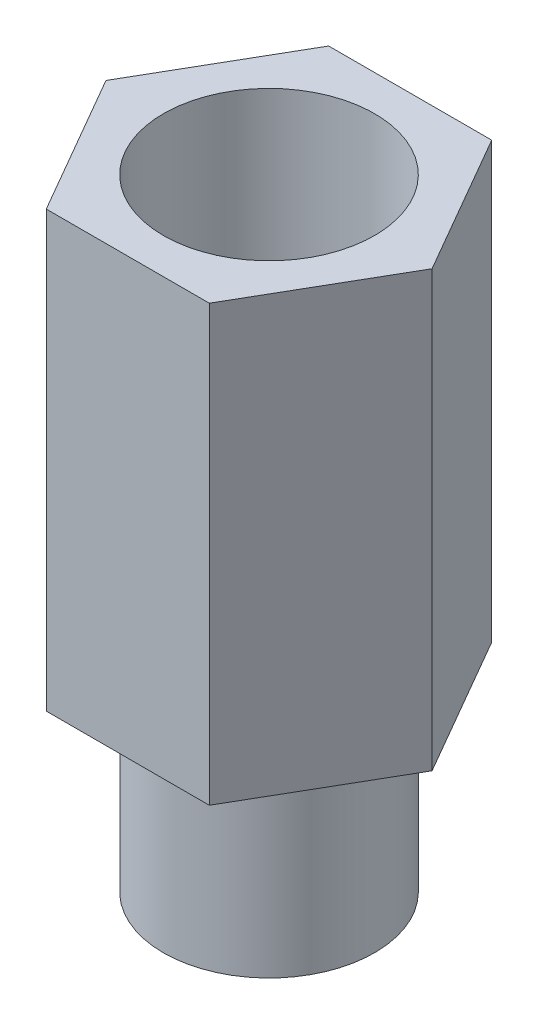
from build123d import *

# Parameters (mm, degrees)
EXTRUDE_1_DEPTH     = 7
SKETCH_2_R          = 1.7
EXTRUDE_2_DEPTH     = 3
SKETCH_3_R          = 1.7
CUT_EXTRUDE_1_DEPTH = 4


with BuildPart() as part:
    # 草图1 → 凸台-拉伸1 (new body)
    with BuildSketch(Plane(origin=(0, 0, 0), x_dir=(1, 0, 0), z_dir=(0, 1, 0))):
        Polygon((1.3125, -2.273316685), (2.625, 0), (1.3125, 2.273316685), (-1.3125, 2.273316685), (-2.625, 0), (-1.3125, -2.273316685), align=None)
    extrude(amount=EXTRUDE_1_DEPTH)

    # 草图2 → 凸台-拉伸2 (add)
    with BuildSketch(Plane(origin=(0, 0, 0), x_dir=(1, 0, 0), z_dir=(0, 1, 0))):
        with Locations(Location((0, 0, 0), (0, 0, 270))):
            Circle(SKETCH_2_R)
    extrude(amount=-EXTRUDE_2_DEPTH)

    # 草图3 → 切除-拉伸1 (cut)
    with BuildSketch(Plane(origin=(0, 7, 0), x_dir=(1, 0, 0), z_dir=(0, 1, 0))):
        with Locations(Location((0, 0, 0), (0, 0, 270))):
            Circle(SKETCH_3_R)
    extrude(amount=-CUT_EXTRUDE_1_DEPTH, mode=Mode.SUBTRACT)


solid = part.part
